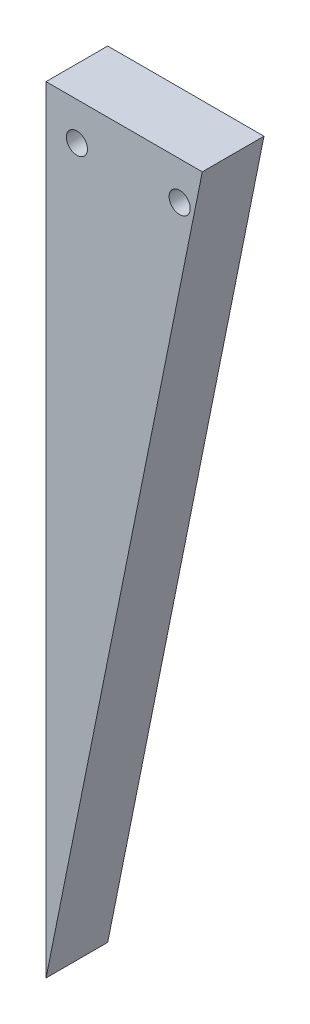
from build123d import *

# Parameters (mm, degrees)
BOSS_EXTRUDE1_DEPTH   = 9.525
F_4_CLEARANCE_HOLE1_D = 3.2639


with BuildPart() as part:
    # Sketch1 → Boss-Extrude1 (new body)
    with BuildSketch(Plane.XY):
        Polygon((0, 0), (0, -119.888), (24.13, 0), align=None)
    extrude(amount=BOSS_EXTRUDE1_DEPTH)

    # #4 Clearance Hole1 (through all)
    with Locations(Plane.XY.offset(9.525)):
        with Locations((20.6375, -5.842), (4.7625, -5.842)):
            Hole(F_4_CLEARANCE_HOLE1_D / 2)


solid = part.part
